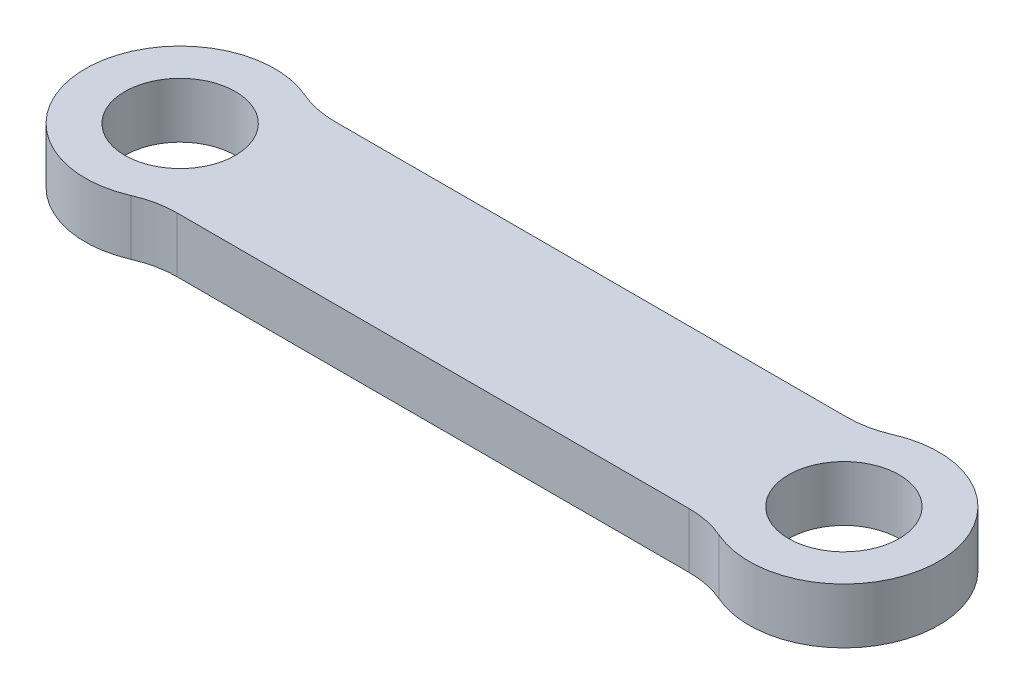
from build123d import *

# Parameters (mm, degrees)
SKETCH1_R           = 1.75
BOSS_EXTRUDE1_DEPTH = 1.75
FILLET1_R           = 3


with BuildPart() as part:
    # Sketch1 → Boss-Extrude1 (new body)
    with BuildSketch(Plane(origin=(0, 0, 0), x_dir=(1, 0, 0), z_dir=(0, 1, 0))):
        with BuildLine():
            ThreePointArc((1.658312395, 2.5), (-3, 0), (1.658312395, -2.5))
            Line((1.658312395, -2.5), (19.341687605, -2.5))
            ThreePointArc((19.341687605, -2.5), (24, 0), (19.341687605, 2.5))
            Line((19.341687605, 2.5), (1.658312395, 2.5))
        make_face()
        with Locations(Location((0, 0, 0), (0, 0, 270))):
            Circle(SKETCH1_R, mode=Mode.SUBTRACT)
        with Locations(Location((21, 0, 0), (0, 0, 270))):
            Circle(SKETCH1_R, mode=Mode.SUBTRACT)
    extrude(amount=BOSS_EXTRUDE1_DEPTH)

    # Fillet1
    fillet1_edges = [part.edges().sort_by_distance(p)[0] for p in [
        (19.341687605, 0.875, 2.5),
        (1.658312395, 0.875, 2.5),
        (1.658312395, 0.875, -2.5),
        (19.341687605, 0.875, -2.5),
    ]]
    fillet(fillet1_edges, radius=FILLET1_R)


solid = part.part
